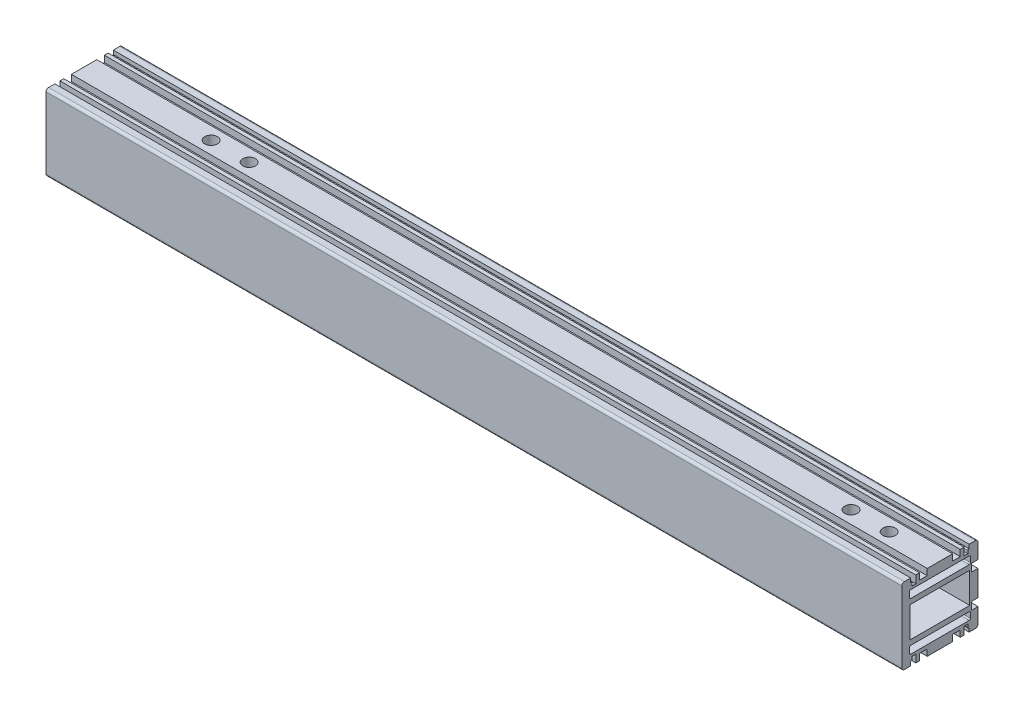
from build123d import *

# Parameters (mm, degrees)
SKETCH_1_W             = 23.5
SKETCH_1_H             = 12
EXTRUDE_1_DEPTH        = 168.5
HOLE_WIZARD_M6_1_D     = 5
HOLE_WIZARD_M6_1_DEPTH = 15
HOLE_WIZARD_M6_1_TIP   = 1.502151548


with BuildPart() as part:
    # 草图1 → 凸台-拉伸1 (new, symmetric)
    with BuildSketch(Plane(origin=(0, 0, 0), x_dir=(0, 0, -1), z_dir=(1, 0, 0))):
        with BuildLine():
            Line((-14, 15), (-11.5, 15))
            Line((-11.5, 15), (-11.5, 13.5))
            Line((-11.5, 13.5), (-11.4, 13.5))
            ThreePointArc((-11.4, 13.5), (-11.117157288, 13.382842712), (-11, 13.1))
            Line((-11, 13.1), (-11, 12))
            Line((-11, 12), (-9.5, 12))
            Line((-9.5, 12), (-9.5, 15))
            Line((-9.5, 15), (-8, 15))
            Line((-8, 15), (-8, 12.5))
            Line((-8, 12.5), (-5, 12.5))
            Line((-5, 12.5), (-5, 15))
            Line((-5, 15), (5, 15))
            Line((5, 15), (5, 12.5))
            Line((5, 12.5), (8, 12.5))
            Line((8, 12.5), (8, 15))
            Line((8, 15), (9.5, 15))
            Line((9.5, 15), (9.5, 12))
            Line((9.5, 12), (11, 12))
            Line((11, 12), (11, 13.1))
            ThreePointArc((11, 13.1), (11.117157288, 13.382842712), (11.4, 13.5))
            Line((11.4, 13.5), (11.5, 13.5))
            Line((11.5, 13.5), (11.5, 15))
            Line((11.5, 15), (14, 15))
            ThreePointArc((14, 15), (14.707106781, 14.707106781), (15, 14))
            Line((15, 14), (15, 8))
            Line((15, 8), (12.5, 8))
            Line((12.5, 8), (12.5, 5))
            Line((12.5, 5), (15, 5))
            Line((15, 5), (15, -5))
            Line((15, -5), (12.5, -5))
            Line((12.5, -5), (12.5, -8))
            Line((12.5, -8), (15, -8))
            Line((15, -8), (15, -14))
            ThreePointArc((15, -14), (14.707106781, -14.707106781), (14, -15))
            Line((14, -15), (11.5, -15))
            Line((11.5, -15), (11.5, -13.5))
            Line((11.5, -13.5), (11.4, -13.5))
            ThreePointArc((11.4, -13.5), (11.117157288, -13.382842712), (11, -13.1))
            Line((11, -13.1), (11, -12))
            Line((11, -12), (9.5, -12))
            Line((9.5, -12), (9.5, -15))
            Line((9.5, -15), (8, -15))
            Line((8, -15), (8, -12.5))
            Line((8, -12.5), (5, -12.5))
            Line((5, -12.5), (5, -15))
            Line((5, -15), (-5, -15))
            Line((-5, -15), (-5, -12.5))
            Line((-5, -12.5), (-8, -12.5))
            Line((-8, -12.5), (-8, -15))
            Line((-8, -15), (-9.5, -15))
            Line((-9.5, -15), (-9.5, -12))
            Line((-9.5, -12), (-11, -12))
            Line((-11, -12), (-11, -13.1))
            ThreePointArc((-11, -13.1), (-11.117157288, -13.382842712), (-11.4, -13.5))
            Line((-11.4, -13.5), (-11.5, -13.5))
            Line((-11.5, -13.5), (-11.5, -15))
            Line((-11.5, -15), (-14, -15))
            ThreePointArc((-14, -15), (-14.707106781, -14.707106781), (-15, -14))
            Line((-15, -14), (-15, 14))
            ThreePointArc((-15, 14), (-14.707106781, 14.707106781), (-14, 15))
        make_face()
        with BuildLine():
            Line((12, -10.5), (12, -8.5))
            ThreePointArc((12, -8.5), (11.853553391, -8.146446609), (11.5, -8))
            Line((11.5, -8), (-11.5, -8))
            ThreePointArc((-11.5, -8), (-11.853553391, -8.146446609), (-12, -8.5))
            Line((-12, -8.5), (-12, -10.5))
            ThreePointArc((-12, -10.5), (-11.853553391, -10.853553391), (-11.5, -11))
            Line((-11.5, -11), (11.5, -11))
            ThreePointArc((11.5, -11), (11.853553391, -10.853553391), (12, -10.5))
        make_face(mode=Mode.SUBTRACT)
        with BuildLine():
            Line((-11.5, 11), (11.5, 11))
            ThreePointArc((11.5, 11), (11.853553391, 10.853553391), (12, 10.5))
            Line((12, 10.5), (12, 8.5))
            ThreePointArc((12, 8.5), (11.853553391, 8.146446609), (11.5, 8))
            Line((11.5, 8), (-11.5, 8))
            ThreePointArc((-11.5, 8), (-11.853553391, 8.146446609), (-12, 8.5))
            Line((-12, 8.5), (-12, 10.5))
            ThreePointArc((-12, 10.5), (-11.853553391, 10.853553391), (-11.5, 11))
        make_face(mode=Mode.SUBTRACT)
        Rectangle(SKETCH_1_W, SKETCH_1_H, mode=Mode.SUBTRACT)
    extrude(amount=EXTRUDE_1_DEPTH, both=True)

    # M6 螺纹孔1
    with Locations(Plane(origin=(0, 15, 0), x_dir=(-1, 0, 0), z_dir=(0, 1, 0))):
        with Locations((-148.5, 0), (-133.5, 0), (103.5, 0), (118.5, 0)):
            Hole(HOLE_WIZARD_M6_1_D / 2, depth=HOLE_WIZARD_M6_1_DEPTH)
            with Locations((0, 0, -(HOLE_WIZARD_M6_1_DEPTH + HOLE_WIZARD_M6_1_TIP / 2))):  # 118° drill point
                Cone(0, HOLE_WIZARD_M6_1_D / 2, HOLE_WIZARD_M6_1_TIP, mode=Mode.SUBTRACT)


solid = part.part
